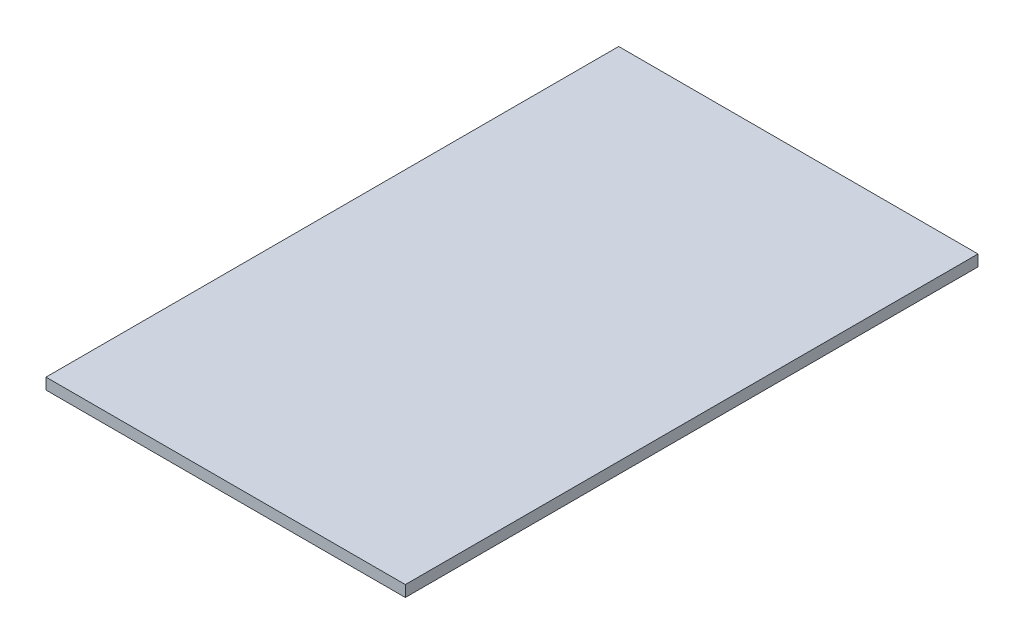
from build123d import *

# Parameters (mm, degrees)
SKETCH1_W           = 203.2
SKETCH1_H           = 323.85
BOSS_EXTRUDE1_DEPTH = 6.35


with BuildPart() as part:
    # Sketch1 → Boss-Extrude1 (new body)
    with BuildSketch(Plane(origin=(0, 0, 0), x_dir=(1, 0, 0), z_dir=(0, 1, 0))):
        with Locations((72.098542205, 118.520634352)):
            Rectangle(SKETCH1_W, SKETCH1_H)
    extrude(amount=BOSS_EXTRUDE1_DEPTH)


solid = part.part
